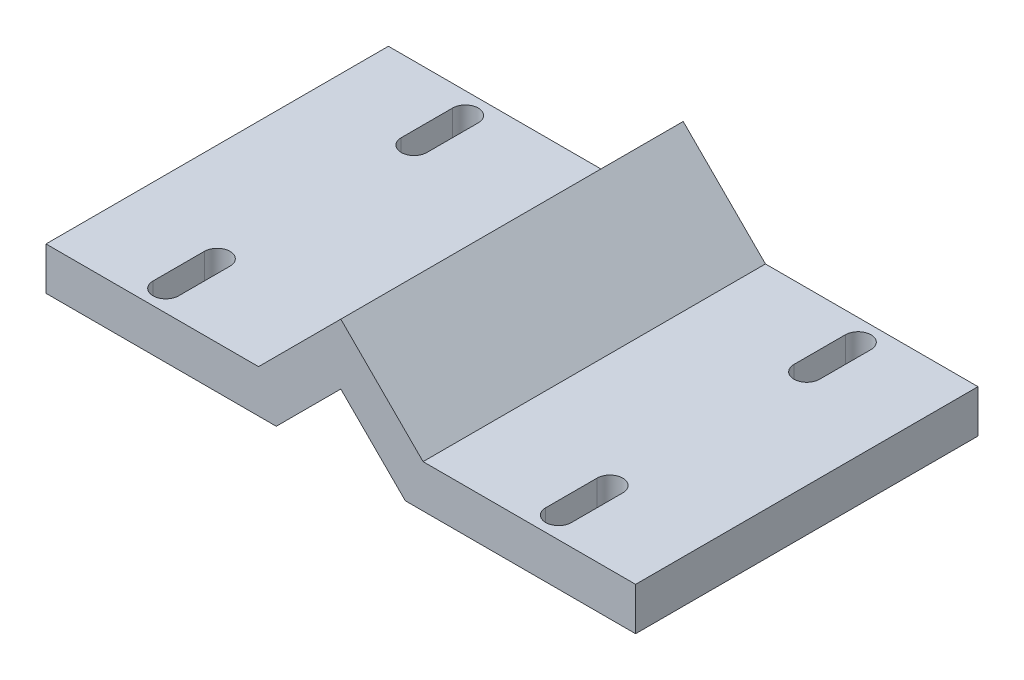
from build123d import *

# Parameters (mm, degrees)
BOSS_EXTRUDE1_DEPTH = 40
CUT_EXTRUDE1_DEPTH  = 10


with BuildPart() as part:
    # Sketch1 → Boss-Extrude1 (new body)
    with BuildSketch(Plane.XY):
        Polygon((0, 0), (-7.54, -7.54), (-34.44, -7.54), (-34.44, -2.54), (-9.611067812, -2.54), (0, 7.071067812), (9.611067812, -2.54), (34.44, -2.54), (34.44, -7.54), (7.54, -7.54), align=None)
    extrude(amount=BOSS_EXTRUDE1_DEPTH)

    # Sketch3 → Cut-Extrude1 (cut)
    with BuildSketch(Plane(origin=(0, -2.54, 0), x_dir=(1, 0, 0), z_dir=(0, 1, 0))):
        with BuildLine():
            Line((-21.439684651, -8.5), (-21.439684651, -2.5))
            ThreePointArc((-21.439684651, -2.5), (-22.94, -0.999684651), (-24.440315349, -2.5))
            Line((-24.440315349, -2.5), (-24.440315349, -8.5))
            ThreePointArc((-24.440315349, -8.5), (-22.94, -10.000315349), (-21.439684651, -8.5))
        make_face()
        with BuildLine():
            Line((24.440315349, -8.5), (24.440315349, -2.5))
            ThreePointArc((24.440315349, -2.5), (22.94, -0.999684651), (21.439684651, -2.5))
            Line((21.439684651, -2.5), (21.439684651, -8.5))
            ThreePointArc((21.439684651, -8.5), (22.94, -10.000315349), (24.440315349, -8.5))
        make_face()
        with BuildLine():
            Line((-21.439684651, -37.5), (-21.439684651, -31.5))
            ThreePointArc((-21.439684651, -31.5), (-22.94, -29.999684651), (-24.440315349, -31.5))
            Line((-24.440315349, -31.5), (-24.440315349, -37.5))
            ThreePointArc((-24.440315349, -37.5), (-22.94, -39.000315349), (-21.439684651, -37.5))
        make_face()
        with BuildLine():
            Line((24.440315349, -37.5), (24.440315349, -31.5))
            ThreePointArc((24.440315349, -31.5), (22.94, -29.999684651), (21.439684651, -31.5))
            Line((21.439684651, -31.5), (21.439684651, -37.5))
            ThreePointArc((21.439684651, -37.5), (22.94, -39.000315349), (24.440315349, -37.5))
        make_face()
    extrude(amount=-CUT_EXTRUDE1_DEPTH, mode=Mode.SUBTRACT)


solid = part.part
